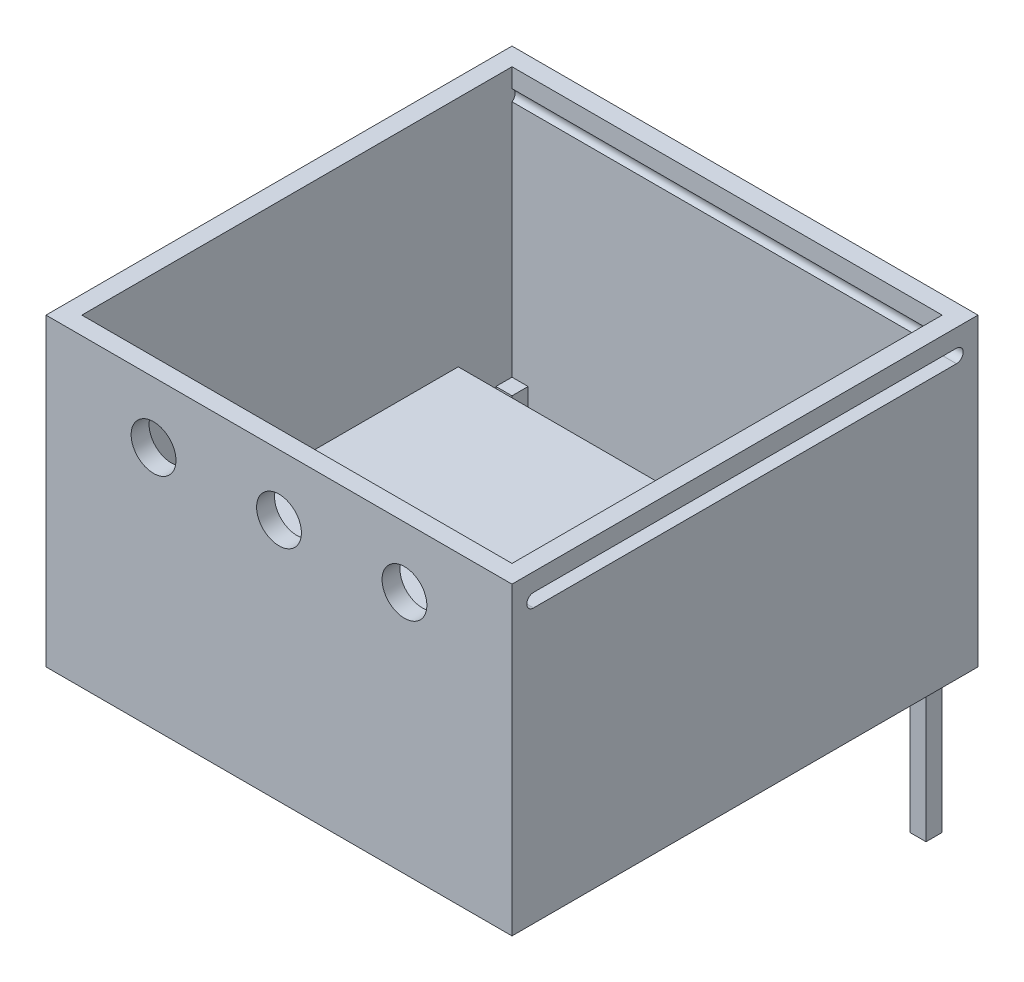
from build123d import *

# Parameters (mm, degrees)
SKIZZE1_W                                = 50
SKIZZE1_H                                = 50
AUFSATZ_LINEAR_AUSTRAGEN1_DEPTH          = 8
SKIZZE2_W                                = 52
SKIZZE2_H                                = 52
SKIZZE2_W_2                              = 48
SKIZZE2_H_2                              = 48
LINEAR_AUSTRAGEN_D_NN1_DEPTH             = 26
LINEAR_AUSTRAGEN_D_NN1_DIRECTION_2_REACH = 38.249
SCHNITT_LINEAR_AUSTRAGEN1_REACH          = 69.35
SCHNITT_LINEAR_AUSTRAGEN2_REACH          = 47.033
SKIZZE4_W                                = 48
SKIZZE4_H                                = 6
SCHNITT_LINEAR_AUSTRAGEN3_REACH          = 69.35
SKIZZE5_R                                = 2.5
AUFSATZ_LINEAR_AUSTRAGEN2_DEPTH          = 16
AUFSATZ_LINEAR_AUSTRAGEN2_DEPTH_BACK     = 4
SKIZZE6_W                                = 1.8
SKIZZE6_H                                = 1.8
AUFSATZ_LINEAR_AUSTRAGEN2_2_DEPTH        = 16
AUFSATZ_LINEAR_AUSTRAGEN2_2_DEPTH_BACK   = 4


with BuildPart() as part:
    # Skizze1 → Aufsatz-Linear austragen1 (new body)
    with BuildSketch(Plane(origin=(0, 0, 0), x_dir=(1, 0, 0), z_dir=(0, 1, 0))):
        Rectangle(SKIZZE1_W, SKIZZE1_H)
    extrude(amount=AUFSATZ_LINEAR_AUSTRAGEN1_DEPTH)

    # Skizze2 → Linear-Austragen-Dünn1 (add)
    with BuildSketch(Plane(origin=(0, 8, 0), x_dir=(1, 0, 0), z_dir=(0, 1, 0))):
        Rectangle(SKIZZE2_W, SKIZZE2_H)
        Rectangle(SKIZZE2_W_2, SKIZZE2_H_2, mode=Mode.SUBTRACT)
    extrude(amount=LINEAR_AUSTRAGEN_D_NN1_DEPTH)

    # Linear-Austragen-Dünn1 direction 2: up to this face of the body (flat: up to its plane)
    linear_austragen_d_nn1_direction_2_end = Plane(part.part.faces().sort_by_distance((0, 0, 0))[0])
    # Skizze2 → Linear-Austragen-Dünn1 direction 2 (add, up to the picked face)
    with BuildSketch(Plane(origin=(0, 8, 0), x_dir=(1, 0, 0), z_dir=(0, 1, 0)), mode=Mode.PRIVATE) as linear_austragen_d_nn1_direction_2_sk1:
        Rectangle(SKIZZE2_W, SKIZZE2_H)
        Rectangle(SKIZZE2_W_2, SKIZZE2_H_2, mode=Mode.SUBTRACT)
    linear_austragen_d_nn1_direction_2_tool1 = split(extrude(linear_austragen_d_nn1_direction_2_sk1.sketch, amount=-LINEAR_AUSTRAGEN_D_NN1_DIRECTION_2_REACH, mode=Mode.PRIVATE), bisect_by=linear_austragen_d_nn1_direction_2_end, keep=Keep.BOTH, mode=Mode.PRIVATE)
    add(linear_austragen_d_nn1_direction_2_tool1.solids().sort_by(Axis((0, 8, 25.264609), (0, -1, 0)))[0])

    # Schnitt-Linear austragen1: up to this face of the body (flat: up to its plane)
    schnitt_linear_austragen1_end = Plane(part.part.faces().sort_by_distance((-24, 21, 0))[0])
    # Skizze3 → Schnitt-Linear austragen1 (cut, up to the picked face)
    with BuildSketch(Plane(origin=(26, 0, 0), x_dir=(0, 0, -1), z_dir=(1, 0, 0)), mode=Mode.PRIVATE) as schnitt_linear_austragen1_sk1:
        with BuildLine():
            Line((-23.6, 32), (23.6, 32))
            ThreePointArc((23.6, 32), (24.35, 31.25), (23.6, 30.5))
            Line((23.6, 30.5), (-23.6, 30.5))
            ThreePointArc((-23.6, 30.5), (-24.35, 31.25), (-23.6, 32))
        make_face()
    schnitt_linear_austragen1_tool1 = split(extrude(schnitt_linear_austragen1_sk1.sketch, amount=-SCHNITT_LINEAR_AUSTRAGEN1_REACH, mode=Mode.PRIVATE), bisect_by=schnitt_linear_austragen1_end, keep=Keep.BOTH, mode=Mode.PRIVATE)
    add(schnitt_linear_austragen1_tool1.solids().sort_by(Axis((26, 31.25, 0), (-1, 0, 0)))[0], mode=Mode.SUBTRACT)

    # Skizze4 → Schnitt-Linear austragen2 (cut, up to next)
    with BuildSketch(Plane(origin=(0, 8, 0), x_dir=(1, 0, 0), z_dir=(0, 1, 0)), mode=Mode.PRIVATE) as schnitt_linear_austragen2_sk1:
        with Locations((0, 21)):
            Rectangle(SKIZZE4_W, SKIZZE4_H)
    schnitt_linear_austragen2_tool1 = extrude(schnitt_linear_austragen2_sk1.sketch, amount=-SCHNITT_LINEAR_AUSTRAGEN2_REACH, mode=Mode.PRIVATE) & part.part
    add(schnitt_linear_austragen2_tool1.solids().sort_by_distance((0, 8, -21))[0], mode=Mode.SUBTRACT)

    # Skizze5 → Schnitt-Linear austragen3 (cut, up to next)
    with BuildSketch(Plane.XY.offset(26), mode=Mode.PRIVATE) as schnitt_linear_austragen3_sk1:
        with Locations((-14, 27.2)):
            Circle(SKIZZE5_R)
    schnitt_linear_austragen3_tool1 = extrude(schnitt_linear_austragen3_sk1.sketch, amount=-SCHNITT_LINEAR_AUSTRAGEN3_REACH, mode=Mode.PRIVATE) & part.part
    # Skizze5 → Schnitt-Linear austragen3 (cut, up to next)
    with BuildSketch(Plane.XY.offset(26), mode=Mode.PRIVATE) as schnitt_linear_austragen3_sk2:
        with Locations((0, 27.2)):
            Circle(SKIZZE5_R)
    schnitt_linear_austragen3_tool2 = extrude(schnitt_linear_austragen3_sk2.sketch, amount=-SCHNITT_LINEAR_AUSTRAGEN3_REACH, mode=Mode.PRIVATE) & part.part
    # Skizze5 → Schnitt-Linear austragen3 (cut, up to next)
    with BuildSketch(Plane.XY.offset(26), mode=Mode.PRIVATE) as schnitt_linear_austragen3_sk3:
        with Locations((14, 27.2)):
            Circle(SKIZZE5_R)
    schnitt_linear_austragen3_tool3 = extrude(schnitt_linear_austragen3_sk3.sketch, amount=-SCHNITT_LINEAR_AUSTRAGEN3_REACH, mode=Mode.PRIVATE) & part.part
    add(schnitt_linear_austragen3_tool1.solids().sort_by_distance((-14, 27.2, 26))[0], mode=Mode.SUBTRACT)
    add(schnitt_linear_austragen3_tool2.solids().sort_by_distance((0, 27.2, 26))[0], mode=Mode.SUBTRACT)
    add(schnitt_linear_austragen3_tool3.solids().sort_by_distance((14, 27.2, 26))[0], mode=Mode.SUBTRACT)


with BuildPart() as body_2:
    # Skizze6 → Aufsatz-Linear austragen2 (new, two sides: drawn at the far end of the back side and taken through both)
    with BuildSketch(Plane.XZ.offset(-AUFSATZ_LINEAR_AUSTRAGEN2_DEPTH_BACK)):
        with Locations((-23.1, -23.1)):
            Rectangle(SKIZZE6_W, SKIZZE6_H)
    extrude(amount=AUFSATZ_LINEAR_AUSTRAGEN2_DEPTH + AUFSATZ_LINEAR_AUSTRAGEN2_DEPTH_BACK)


with BuildPart() as body_3:
    # Skizze6 → Aufsatz-Linear austragen2 2 (new, two sides: drawn at the far end of the back side and taken through both)
    with BuildSketch(Plane.XZ.offset(-AUFSATZ_LINEAR_AUSTRAGEN2_2_DEPTH_BACK)):
        with Locations((23.1, -23.1)):
            Rectangle(SKIZZE6_W, SKIZZE6_H)
    extrude(amount=AUFSATZ_LINEAR_AUSTRAGEN2_2_DEPTH + AUFSATZ_LINEAR_AUSTRAGEN2_2_DEPTH_BACK)


solid = Compound([part.part, body_2.part, body_3.part])
